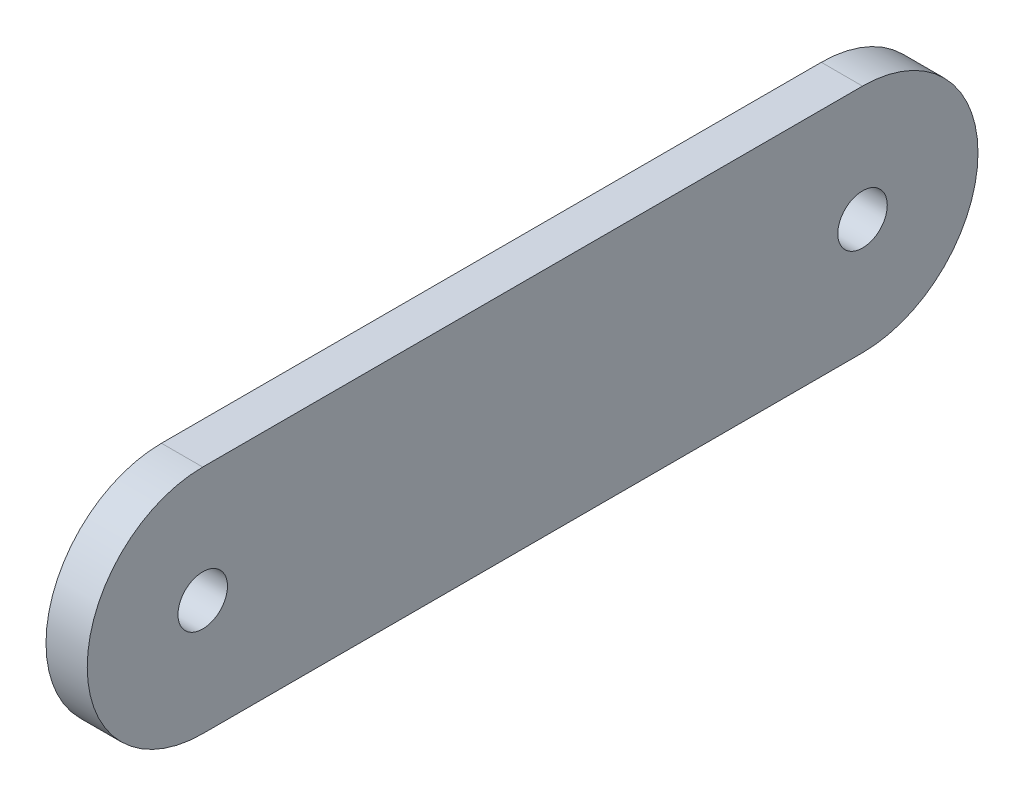
from build123d import *

# Parameters (mm, degrees)
SKETCH1_R           = 1.5
BOSS_EXTRUDE1_DEPTH = 2.5


with BuildPart() as part:
    # Sketch1 → Boss-Extrude1 (new body)
    with BuildSketch(Plane(origin=(0, 0, 0), x_dir=(0, 0, -1), z_dir=(1, 0, 0))):
        with BuildLine():
            Line((0, -7), (-40, -7))
            ThreePointArc((-40, -7), (-47, 0), (-40, 7))
            Line((-40, 7), (0, 7))
            ThreePointArc((0, 7), (7, 0), (0, -7))
        make_face()
        with Locations((-40, 0)):
            Circle(SKETCH1_R, mode=Mode.SUBTRACT)
        Circle(SKETCH1_R, mode=Mode.SUBTRACT)
    extrude(amount=BOSS_EXTRUDE1_DEPTH)


solid = part.part
